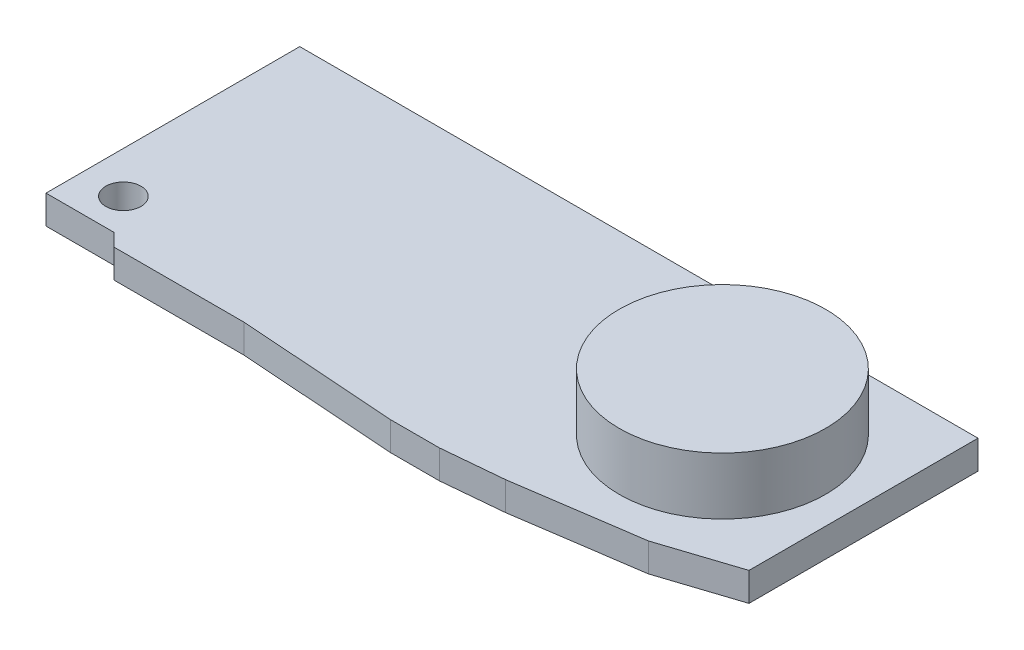
from build123d import *

# Parameters (mm, degrees)
SKETCH_1_R      = 1.229324964
SKETCH_1_R_2    = 1.149420027
EXTRUDE_1_DEPTH = 2
SKETCH_2_R      = 7.221294113
EXTRUDE_2_DEPTH = 4
SKETCH_3_W      = 2.645095026
SKETCH_3_H      = 3.141050342
SKETCH_3_W_2    = 1.884630206
SKETCH_3_H_2    = 3.041859279
SKETCH_3_W_3    = 1.96408086
SKETCH_3_H_3    = 3.372496157
SKETCH_3_W_4    = 2.57896765
SKETCH_3_H_4    = 3.008795591
EXTRUDE_3_DEPTH = 2.5


with BuildPart() as part:
    # 草图1 → 凸台-拉伸1 (new body)
    with BuildSketch(Plane(origin=(0, 0, 0), x_dir=(1, 0, 0), z_dir=(0, 1, 0))):
        Polygon((-27.440284042, -0.784220791), (20.007371412, -0.784220791), (20.007371412, -16.804782103), (14.704398156, -18.535226008), (5.996357861, -19.819103743), (1.753979255, -20.209849141), (-1.651087783, -20.209849141), (-12.703600465, -19.428358346), (-21.802386158, -19.428358346), (-22.695518496, -18.535226008), (-27.440284042, -18.535226008), align=None)
        with Locations(Location((-24.537603943, -16.023291307, 0), (0, 0, 270))):
            Circle(SKETCH_1_R, mode=Mode.SUBTRACT)
        with Locations(Location((3.093677762, -3.072872407, 0), (0, 0, 270))):
            Circle(SKETCH_1_R_2, mode=Mode.SUBTRACT)
    extrude(amount=EXTRUDE_1_DEPTH)

    # 草图2 → 凸台-拉伸2 (add)
    with BuildSketch(Plane(origin=(0, 2, 0), x_dir=(1, 0, 0), z_dir=(0, 1, 0))):
        with Locations(Location((10.864630012, -9.521656176, 0), (0, 0, 270))):
            Circle(SKETCH_2_R)
    extrude(amount=EXTRUDE_2_DEPTH)

    # 草图3 → 凸台-拉伸3 (add)
    with BuildSketch(Plane(origin=(0, 0, 0), x_dir=(-1, 0, 0), z_dir=(0, -1, 0))):
        with Locations((24.315133823, -7.322920936)):
            Rectangle(SKETCH_3_W, SKETCH_3_H)
        with Locations((9.552197214, -7.736217034)):
            Rectangle(SKETCH_3_W_2, SKETCH_3_H_2)
        with Locations((0.98204043, -7.901535473)):
            Rectangle(SKETCH_3_W_3, SKETCH_3_H_3)
        with Locations((-11.029948451, -8.083385756)):
            Rectangle(SKETCH_3_W_4, SKETCH_3_H_4)
    extrude(amount=EXTRUDE_3_DEPTH)


solid = part.part
